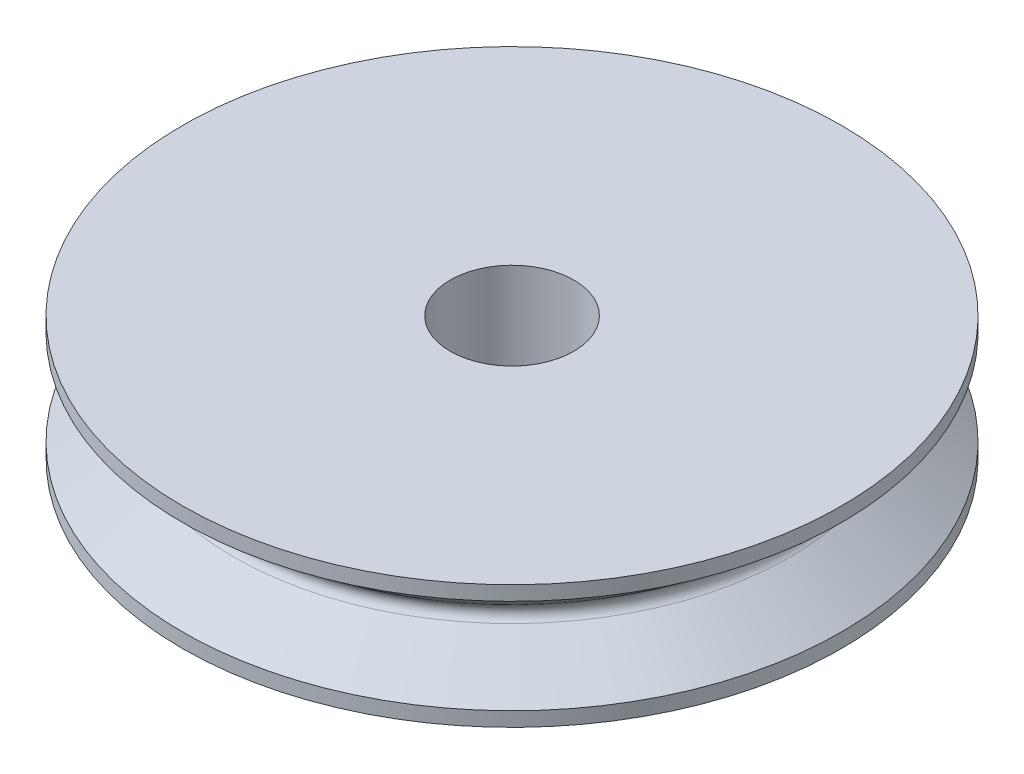
from build123d import *

# Parameters (mm, degrees)
SKETCH_1_R          = 16
EXTRUDE_1_DEPTH     = 6
SKETCH_4_R          = 3
CUT_EXTRUDE_2_DEPTH = 24.409399821


with BuildPart() as part:
    # Эскиз1 → Вытянуть1 (new body)
    with BuildSketch(Plane(origin=(0, 0, 0), x_dir=(1, 0, 0), z_dir=(0, 1, 0))):
        with Locations(Location((0, 0, 0), (0, 0, 270))):
            Circle(SKETCH_1_R)
    extrude(amount=EXTRUDE_1_DEPTH)

    # Эскиз2 → Вырез-Повернуть1 (revolve, cut)
    with BuildSketch(Plane.XY, mode=Mode.PRIVATE) as cut_revolve_1_sk:
        with BuildLine():
            Line((16, 0.7), (13.508420421, 2.60261237))
            ThreePointArc((13.508420421, 2.60261237), (13.311872347, 3), (13.508420421, 3.39738763))
            Line((13.508420421, 3.39738763), (16, 5.3))
            Line((16, 5.3), (16, 0.7))
        make_face()
    revolve(cut_revolve_1_sk.sketch.rotate(Axis((0, 0, 0), (0, 1, 0)), 90), axis=Axis((0, 0, 0), (0, 1, 0)), mode=Mode.SUBTRACT)

    # Эскиз4 → Вытянуть2 (cut, through all)
    with BuildSketch(Plane(origin=(0, 6, 0), x_dir=(1, 0, 0), z_dir=(0, 1, 0))):
        with Locations(Location((0, 0, 0), (0, 0, 270))):
            Circle(SKETCH_4_R)
    extrude(amount=-CUT_EXTRUDE_2_DEPTH, mode=Mode.SUBTRACT)


solid = part.part
